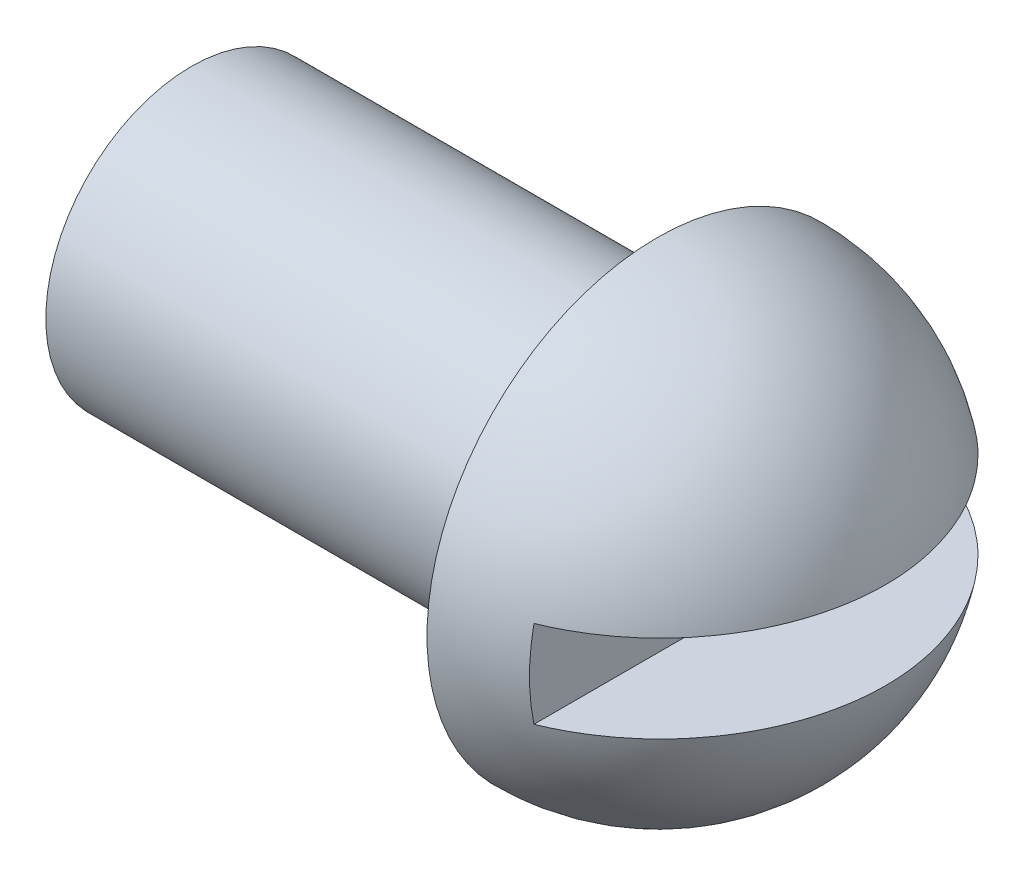
from build123d import *

# Parameters (mm, degrees)
CORTE_EXTRUS_O1_DEPTH      = 14.238697312
CORTE_EXTRUS_O1_DEPTH_BACK = 14.238697312
ESBO_O2_W                  = 3.17038165
ESBO_O2_H                  = 1.5


with BuildPart() as part:
    # Esboço1 → Revolução1 (revolve)
    with BuildSketch(Plane.XY):
        with BuildLine():
            Line((0, 0), (0, 2.5))
            Line((0, 2.5), (8, 2.5))
            Line((8, 2.5), (8, 3.953675657))
            ThreePointArc((8, 3.953675657), (10.812174165, 2.798528059), (12, 0))
            Line((12, 0), (0, 0))
        make_face()
    revolve(axis=Axis((12, 0, 0), (-1, 0, 0)))

    # Esboço2 → Corte-extrusão1 (cut, two sides: drawn at the far end of the back side and taken through both)
    with BuildSketch(Plane.XY.offset(-CORTE_EXTRUS_O1_DEPTH_BACK)):
        with Locations((11.06193306, 0)):
            Rectangle(ESBO_O2_W, ESBO_O2_H)
    extrude(amount=CORTE_EXTRUS_O1_DEPTH + CORTE_EXTRUS_O1_DEPTH_BACK, mode=Mode.SUBTRACT)


solid = part.part
